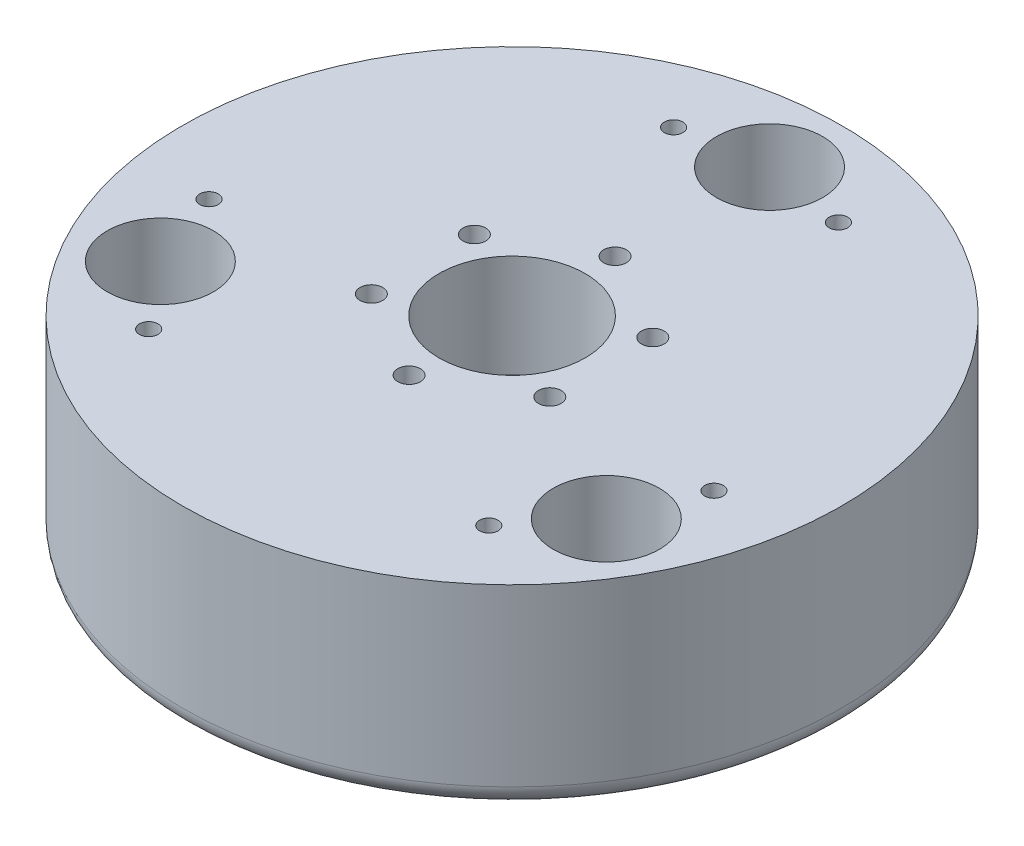
from build123d import *

# Parameters (mm, degrees)
SKETCH_1_R          = 32
SKETCH_1_R_2        = 4
SKETCH_1_R_3        = 3
EXTRUDE_1_DEPTH     = 19
FILLET_1_R          = 2
SKETCH_2_R          = 5.15
CUT_EXTRUDE_1_DEPTH = 15.2
SKETCH_3_R          = 2.55
CUT_EXTRUDE_2_DEPTH = 15
SKETCH_4_R          = 1.1
CUT_EXTRUDE_3_DEPTH = 50.081564832
SKETCH_7_R          = 1.8
CUT_EXTRUDE_5_DEPTH = 3
CHAMFER_1_SIZE      = 1
SKETCH_8_R          = 7.1
CUT_EXTRUDE_6_DEPTH = 10
SKETCH_9_R          = 0.9
CUT_EXTRUDE_7_DEPTH = 50.081564832


with BuildPart() as part:
    # Эскиз1 → Бобышка-Вытянуть1 (new body)
    with BuildSketch(Plane(origin=(0, 0, 0), x_dir=(1, 0, 0), z_dir=(0, 1, 0))):
        with Locations(Location((0, 0, 0), (0, 0, 270))):
            Circle(SKETCH_1_R)
        with Locations(Location((0, 0, 0), (0, 0, 270))):
            Circle(SKETCH_1_R_2, mode=Mode.SUBTRACT)
        with Locations(Location((0, 25, 0), (0, 0, 270))):
            Circle(SKETCH_1_R_3, mode=Mode.SUBTRACT)
        with Locations(Location((21.650635095, -12.5, 0), (0, 0, 270))):
            Circle(SKETCH_1_R_3, mode=Mode.SUBTRACT)
        with Locations(Location((-21.650635095, -12.5, 0), (0, 0, 270))):
            Circle(SKETCH_1_R_3, mode=Mode.SUBTRACT)
    extrude(amount=EXTRUDE_1_DEPTH)

    # Скругление1
    fillet_1_edges = [part.edges().sort_by_distance(p)[0] for p in [
        (0, 0, -32),
    ]]
    fillet(fillet_1_edges, radius=FILLET_1_R)

    # Эскиз2 → Вырез-Вытянуть1 (cut)
    with BuildSketch(Plane(origin=(0, 19, 0), x_dir=(1, 0, 0), z_dir=(0, 1, 0))):
        with Locations(Location((0, 25, 0), (0, 0, 270))):
            Circle(SKETCH_2_R)
        with Locations(Location((21.650635095, -12.5, 0), (0, 0, 270))):
            Circle(SKETCH_2_R)
        with Locations(Location((-21.650635095, -12.5, 0), (0, 0, 270))):
            Circle(SKETCH_2_R)
    extrude(amount=-CUT_EXTRUDE_1_DEPTH, mode=Mode.SUBTRACT)

    # Эскиз3 → Вырез-Вытянуть2 (cut)
    with BuildSketch(Plane.XZ):
        with Locations(Location((0, 25, 0), (0, 0, 270))):
            Circle(SKETCH_3_R)
        with Locations(Location((21.650635095, -12.5, 0), (0, 0, 270))):
            Circle(SKETCH_3_R)
        with Locations(Location((-21.650635095, -12.5, 0), (0, 0, 270))):
            Circle(SKETCH_3_R)
    extrude(amount=-CUT_EXTRUDE_2_DEPTH, mode=Mode.SUBTRACT)

    # Эскиз4 → Вырез-Вытянуть3 (cut, through all)
    with BuildSketch(Plane(origin=(0, 19, 0), x_dir=(1, 0, 0), z_dir=(0, 1, 0))):
        with Locations(Location((0, 10, 0), (0, 0, 270))):
            Circle(SKETCH_4_R)
        with Locations(Location((8.660254038, 5, 0), (0, 0, 270))):
            Circle(SKETCH_4_R)
        with Locations(Location((8.660254038, -5, 0), (0, 0, 270))):
            Circle(SKETCH_4_R)
        with Locations(Location((0, -10, 0), (0, 0, 270))):
            Circle(SKETCH_4_R)
        with Locations(Location((-8.660254038, -5, 0), (0, 0, 270))):
            Circle(SKETCH_4_R)
        with Locations(Location((-8.660254038, 5, 0), (0, 0, 270))):
            Circle(SKETCH_4_R)
    extrude(amount=-CUT_EXTRUDE_3_DEPTH, mode=Mode.SUBTRACT)

    # Эскиз7 → Вырез-Вытянуть5 (cut)
    with BuildSketch(Plane.XZ):
        with Locations(Location((8.660254038, 5, 0), (0, 0, 270))):
            Circle(SKETCH_7_R)
        with Locations(Location((0, -10, 0), (0, 0, 270))):
            Circle(SKETCH_7_R)
        with Locations(Location((-8.660254038, 5, 0), (0, 0, 270))):
            Circle(SKETCH_7_R)
    extrude(amount=-CUT_EXTRUDE_5_DEPTH, mode=Mode.SUBTRACT)

    # Фаска1
    chamfer_1_edges = [part.edges().sort_by_distance(p)[0] for p in [
        (21.650635095, 0, 9.5),
        (-21.650635095, 0, 9.5),
        (0, 0, 27.55),
        (21.650635095, 0, -9.95),
        (-21.650635095, 0, -9.95),
        (0, 0, -4),
        (0, 0, -28),
    ]]
    chamfer(chamfer_1_edges, length=CHAMFER_1_SIZE)

    # Эскиз8 → Вырез-Вытянуть6 (cut)
    with BuildSketch(Plane(origin=(0, 19, 0), x_dir=(1, 0, 0), z_dir=(0, 1, 0))):
        with Locations(Location((0, 0, 0), (0, 0, 270))):
            Circle(SKETCH_8_R)
    extrude(amount=-CUT_EXTRUDE_6_DEPTH, mode=Mode.SUBTRACT)

    # Эскиз9 → Вырез-Вытянуть7 (cut, through all)
    with BuildSketch(Plane(origin=(0, 19, 0), x_dir=(1, 0, 0), z_dir=(0, 1, 0))):
        with Locations(Location((-8, 23.685438565, 0), (0, 0, 270))):
            Circle(SKETCH_9_R)
        with Locations(Location((8, 23.685438565, 0), (0, 0, 270))):
            Circle(SKETCH_9_R)
        with Locations(Location((16.512191497, -18.770922513, 0), (0, 0, 270))):
            Circle(SKETCH_9_R)
        with Locations(Location((24.512191497, -4.914516052, 0), (0, 0, 270))):
            Circle(SKETCH_9_R)
        with Locations(Location((-24.512191497, -4.914516052, 0), (0, 0, 270))):
            Circle(SKETCH_9_R)
        with Locations(Location((-16.512191497, -18.770922513, 0), (0, 0, 270))):
            Circle(SKETCH_9_R)
    extrude(amount=-CUT_EXTRUDE_7_DEPTH, mode=Mode.SUBTRACT)


solid = part.part
